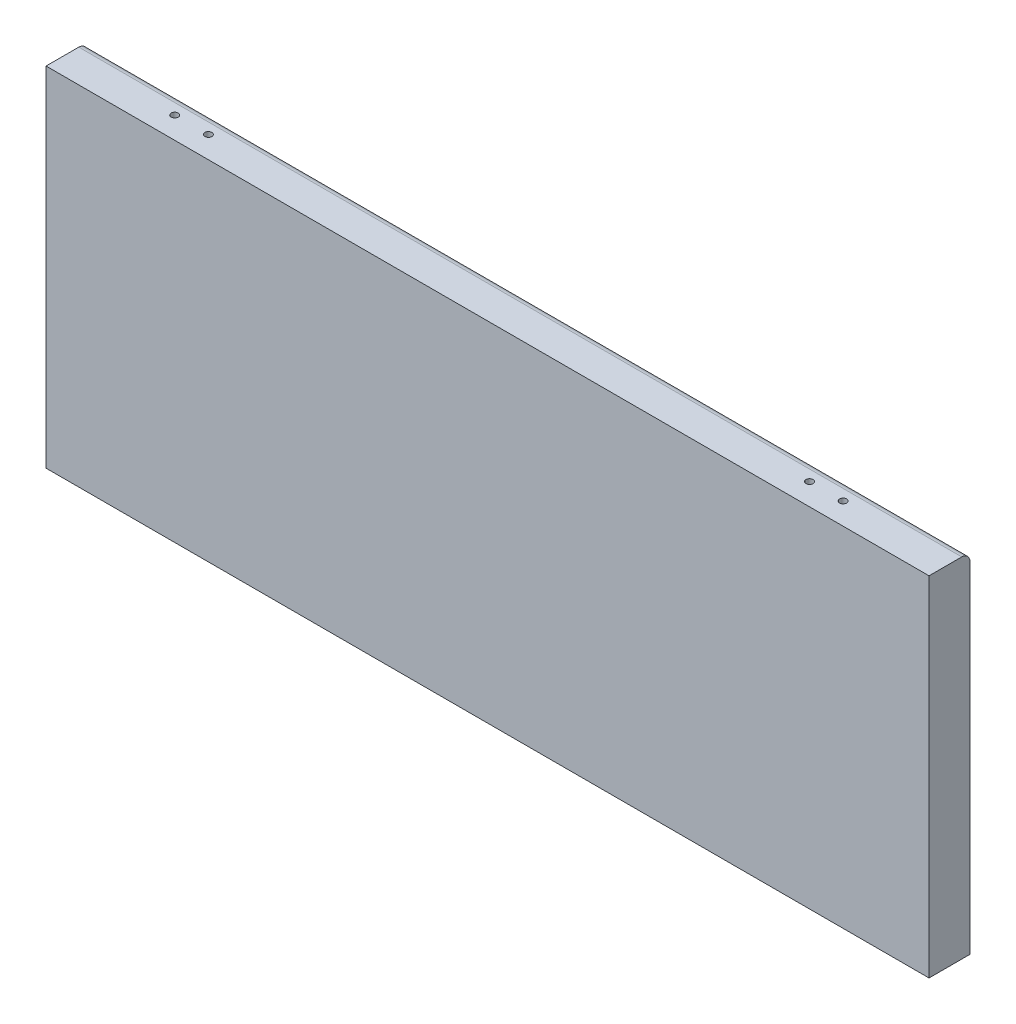
from build123d import *

# Parameters (mm, degrees)
BOSS_EXTRUDE1_START = -80
SKETCH1_W           = 323.749339931
SKETCH1_H           = 127.712624425
BOSS_EXTRUDE1_DEPTH = 4
SKETCH4_W           = 323.749339931
SKETCH4_H           = 127.712624425
SKETCH4_W_2         = 315.749339931
SKETCH4_H_2         = 119.712624425
BOSS_EXTRUDE2_DEPTH = 15
SKETCH6_R           = 1.55
CUT_EXTRUDE2_DEPTH  = 6
SKETCH10_R          = 1.29987
CUT_EXTRUDE3_DEPTH  = 6
FILLET1_R           = 3


with BuildPart() as part:
    # Sketch1 → Boss-Extrude1 (new body)
    with BuildSketch(Plane.XY.offset(BOSS_EXTRUDE1_START)):
        with Locations((196.446669966, 63.856312213)):
            Rectangle(SKETCH1_W, SKETCH1_H)
    extrude(amount=BOSS_EXTRUDE1_DEPTH)

    # Sketch4 → Boss-Extrude2 (add)
    with BuildSketch(Plane.XY.offset(-76)):
        with Locations((196.446669966, 63.856312213)):
            Rectangle(SKETCH4_W, SKETCH4_H)
        with Locations((196.446669966, 63.856312213)):
            Rectangle(SKETCH4_W_2, SKETCH4_H_2, mode=Mode.SUBTRACT)
    extrude(amount=-BOSS_EXTRUDE2_DEPTH)

    # Sketch6 → Cut-Extrude2 (cut)
    with BuildSketch(Plane.XZ):
        with Locations(Location((207.946669965, -84.5, 0), (0, 0, 270))):
            Circle(SKETCH6_R)
        with Locations(Location((184.946669965, -84.5, 0), (0, 0, 270))):
            Circle(SKETCH6_R)
    extrude(amount=-CUT_EXTRUDE2_DEPTH, mode=Mode.SUBTRACT)

    # Sketch10 → Cut-Extrude3 (cut)
    with BuildSketch(Plane(origin=(0, 127.712624425, 0), x_dir=(1, 0, 0), z_dir=(0, 1, 0))):
        with Locations(Location((306.489689931, 84.015230538, 0), (0, 0, 270))):
            Circle(SKETCH10_R)
        with Locations(Location((318.821789931, 84.015230538, 0), (0, 0, 270))):
            Circle(SKETCH10_R)
        with Locations(Location((73.73825, 84.015230538, 0), (0, 0, 270))):
            Circle(SKETCH10_R)
        with Locations(Location((86.07035, 84.015230538, 0), (0, 0, 270))):
            Circle(SKETCH10_R)
    extrude(amount=-CUT_EXTRUDE3_DEPTH, mode=Mode.SUBTRACT)

    # Fillet1
    fillet1_edges = [part.edges().sort_by_distance(p)[0] for p in [
        (196.446669965, 127.712624425, -91),
    ]]
    fillet(fillet1_edges, radius=FILLET1_R)


solid = part.part
